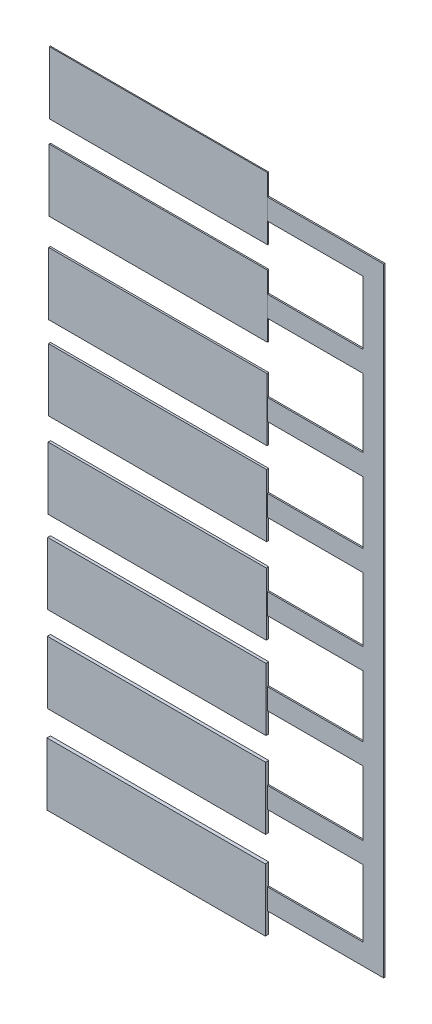
from build123d import *

# Parameters (mm, degrees)
ESBO_O9_W                = 62.789568093
ESBO_O9_H                = 18
RESSALTO_EXTRUS_O9_DEPTH = 0.3
ESBO_O8_W                = 62.789568093
ESBO_O8_H                = 18
RESSALTO_EXTRUS_O8_DEPTH = 0.4
ESBO_O1_W                = 62.789568093
ESBO_O1_H                = 18
RESSALTO_EXTRUS_O1_DEPTH = 0.5
ESBO_O2_W                = 62.789568093
ESBO_O2_H                = 18
RESSALTO_EXTRUS_O2_DEPTH = 0.6
ESBO_O3_W                = 62.789568093
ESBO_O3_H                = 18
RESSALTO_EXTRUS_O3_DEPTH = 0.7
ESBO_O4_W                = 62.789568093
ESBO_O4_H                = 18
RESSALTO_EXTRUS_O4_DEPTH = 0.8
ESBO_O5_W                = 62.789568093
ESBO_O5_H                = 18
RESSALTO_EXTRUS_O5_DEPTH = 0.9
ESBO_O6_W                = 62.789568093
ESBO_O6_H                = 18
RESSALTO_EXTRUS_O6_DEPTH = 1
RESSALTO_EXTRUS_O7_DEPTH = 0.4


with BuildPart() as part:
    # Esboço9 → Ressalto-extrusão9 (new body)
    with BuildSketch(Plane.XY):
        with Locations((39.053642137, 434.235186495)):
            Rectangle(ESBO_O9_W, ESBO_O9_H)
    extrude(amount=RESSALTO_EXTRUS_O9_DEPTH)


with BuildPart() as body_2:
    # Esboço8 → Ressalto-extrusão8 (new body)
    with BuildSketch(Plane.XY):
        with Locations((39.053642137, 410.017111126)):
            Rectangle(ESBO_O8_W, ESBO_O8_H)
    extrude(amount=RESSALTO_EXTRUS_O8_DEPTH)


with BuildPart() as body_3:
    # Esboço1 → Ressalto-extrusão1 (new body)
    with BuildSketch(Plane.XY):
        with Locations((39.053642137, 384.286764873)):
            Rectangle(ESBO_O1_W, ESBO_O1_H)
    extrude(amount=RESSALTO_EXTRUS_O1_DEPTH)



with BuildPart() as body_4:
    # Esboço2 → Ressalto-extrusão2 (new body)
    with BuildSketch(Plane(origin=(0, 0, 0), x_dir=(-1, 0, 0), z_dir=(0, 0, -1))):
        with Locations((-39.053642137, 360.404184905)):
            Rectangle(ESBO_O2_W, ESBO_O2_H)
    extrude(amount=-RESSALTO_EXTRUS_O2_DEPTH)


with BuildPart() as body_5:
    # Esboço3 → Ressalto-extrusão3 (new body)
    with BuildSketch(Plane.XY):
        with Locations((39.053642137, 335.934065626)):
            Rectangle(ESBO_O3_W, ESBO_O3_H)
    extrude(amount=RESSALTO_EXTRUS_O3_DEPTH)


with BuildPart() as body_6:
    # Esboço4 → Ressalto-extrusão4 (new body)
    with BuildSketch(Plane.XY):
        with Locations((39.053642137, 312.234156495)):
            Rectangle(ESBO_O4_W, ESBO_O4_H)
    extrude(amount=RESSALTO_EXTRUS_O4_DEPTH)


with BuildPart() as body_7:
    # Esboço5 → Ressalto-extrusão5 (new body)
    with BuildSketch(Plane.XY):
        with Locations((39.053642137, 287.648513592)):
            Rectangle(ESBO_O5_W, ESBO_O5_H)
    extrude(amount=RESSALTO_EXTRUS_O5_DEPTH)


with BuildPart() as body_8:
    # Esboço6 → Ressalto-extrusão6 (new body)
    with BuildSketch(Plane.XY):
        with Locations((39.053642137, 262.371419277)):
            Rectangle(ESBO_O6_W, ESBO_O6_H)
    extrude(amount=RESSALTO_EXTRUS_O6_DEPTH)


with BuildPart() as body_3_1:
    add(body_3.part)

    add(body_4.part)  # Ressalto-extrusão7 merges body 4

    add(body_5.part)  # Ressalto-extrusão7 merges body 5

    add(body_6.part)  # Ressalto-extrusão7 merges body 6

    add(body_7.part)  # Ressalto-extrusão7 merges body 7

    add(body_8.part)  # Ressalto-extrusão7 merges body 8
    # Esboço7 → Ressalto-extrusão7 (add)
    with BuildSketch(Plane.XY):
        Polygon((97.899546957, 363.404184905), (97.899546957, 381.286764873), (70.448426183, 381.286764873), (70.448426183, 387.286764873), (97.899546957, 387.286764873), (97.899546957, 407.017111126), (70.448426183, 407.017111126), (70.448426183, 413.017111126), (97.899546957, 413.017111126), (97.899546957, 431.235186495), (70.448426183, 431.235186495), (70.448426183, 437.235186495), (103.899546957, 437.235186495), (103.899546957, 387.286764873), (103.899546957, 259.371419277), (70.448426183, 259.371419277), (70.448426183, 265.371419277), (97.899546957, 265.371419277), (97.899546957, 284.648513592), (70.448426183, 284.648513592), (70.448426183, 290.648513592), (97.899546957, 290.648513592), (97.899546957, 309.234156495), (70.448426183, 309.234156495), (70.448426183, 315.234156495), (97.899546957, 315.234156495), (97.899546957, 332.934065626), (70.448426183, 332.934065626), (70.448426183, 338.934065626), (97.899546957, 338.934065626), (97.899546957, 357.404184905), (70.448426183, 357.404184905), (70.448426183, 363.404184905), align=None)
    extrude(amount=RESSALTO_EXTRUS_O7_DEPTH)


solid = Compound([part.part, body_2.part, body_3_1.part])
